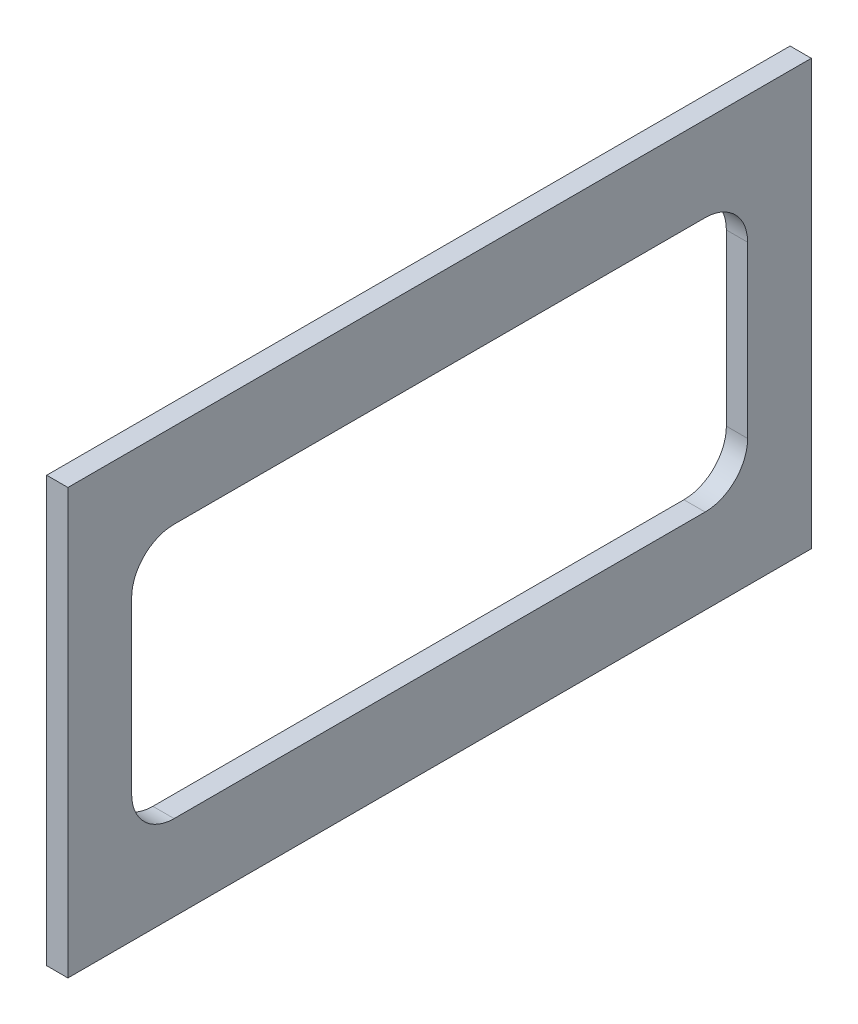
from build123d import *

# Parameters (mm, degrees)
SKETCH3_W           = 111.125
SKETCH3_H           = 63.5
BOSS_EXTRUDE1_DEPTH = 3.175


with BuildPart() as part:
    # Sketch3 → Boss-Extrude1 (new body)
    with BuildSketch(Plane(origin=(0, 0, 0), x_dir=(0, 0, -1), z_dir=(1, 0, 0))):
        Rectangle(SKETCH3_W, SKETCH3_H)
        with BuildLine():
            Line((-39.6875, -19.05), (39.6875, -19.05))
            ThreePointArc((39.6875, -19.05), (44.177628061, -17.190128061), (46.0375, -12.7))
            Line((46.0375, -12.7), (46.0375, 12.7))
            ThreePointArc((46.0375, 12.7), (44.177628061, 17.190128061), (39.6875, 19.05))
            Line((39.6875, 19.05), (-39.6875, 19.05))
            ThreePointArc((-39.6875, 19.05), (-44.177628061, 17.190128061), (-46.0375, 12.7))
            Line((-46.0375, 12.7), (-46.0375, -12.7))
            ThreePointArc((-46.0375, -12.7), (-44.177628061, -17.190128061), (-39.6875, -19.05))
        make_face(mode=Mode.SUBTRACT)
    extrude(amount=BOSS_EXTRUDE1_DEPTH)


solid = part.part
